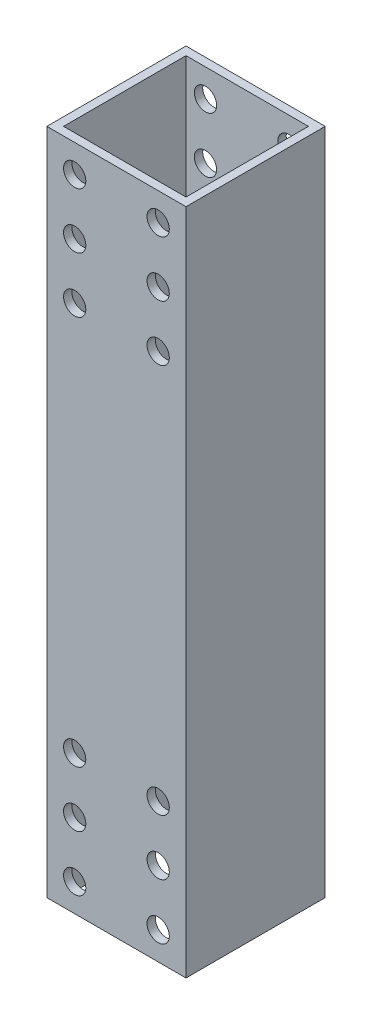
from build123d import *

# Parameters (mm, degrees)
BOSS_EXTRUDE1_DEPTH      = 60
BOSS_EXTRUDE1_DEPTH_BACK = 60
SKETCH1_W                = 25
SKETCH1_H                = 25
SKETCH1_W_2              = 22
SKETCH1_H_2              = 22
SKETCH2_R                = 2
CUT_EXTRUDE1_DEPTH       = 25


with BuildPart() as part:
    # Sketch1 → Boss-Extrude1 (new, two sides: drawn at the far end of the back side and taken through both)
    with BuildSketch(Plane(origin=(0, 0, 0), x_dir=(1, 0, 0), z_dir=(0, 1, 0)).offset(-BOSS_EXTRUDE1_DEPTH_BACK)):
        Rectangle(SKETCH1_W, SKETCH1_H)
        Rectangle(SKETCH1_W_2, SKETCH1_H_2, mode=Mode.SUBTRACT)
    extrude(amount=BOSS_EXTRUDE1_DEPTH + BOSS_EXTRUDE1_DEPTH_BACK)

    # Sketch2 → Cut-Extrude1 (cut)
    with BuildSketch(Plane(origin=(0, 0, -12.5), x_dir=(-1, 0, 0), z_dir=(0, 0, -1))):
        with Locations((7.5, 55)):
            Circle(SKETCH2_R)
        with Locations((7.5, 45)):
            Circle(SKETCH2_R)
        with Locations((-7.5, 55)):
            Circle(SKETCH2_R)
        with Locations((-7.5, 45)):
            Circle(SKETCH2_R)
        with Locations((7.5, 35)):
            Circle(SKETCH2_R)
        with Locations((-7.5, 35)):
            Circle(SKETCH2_R)
    cut_extrude1 = extrude(amount=-CUT_EXTRUDE1_DEPTH, mode=Mode.SUBTRACT)

    # Mirror1: Cut-Extrude1 across plane
    add(cut_extrude1.mirror(Plane.ZX), mode=Mode.SUBTRACT)


solid = part.part
